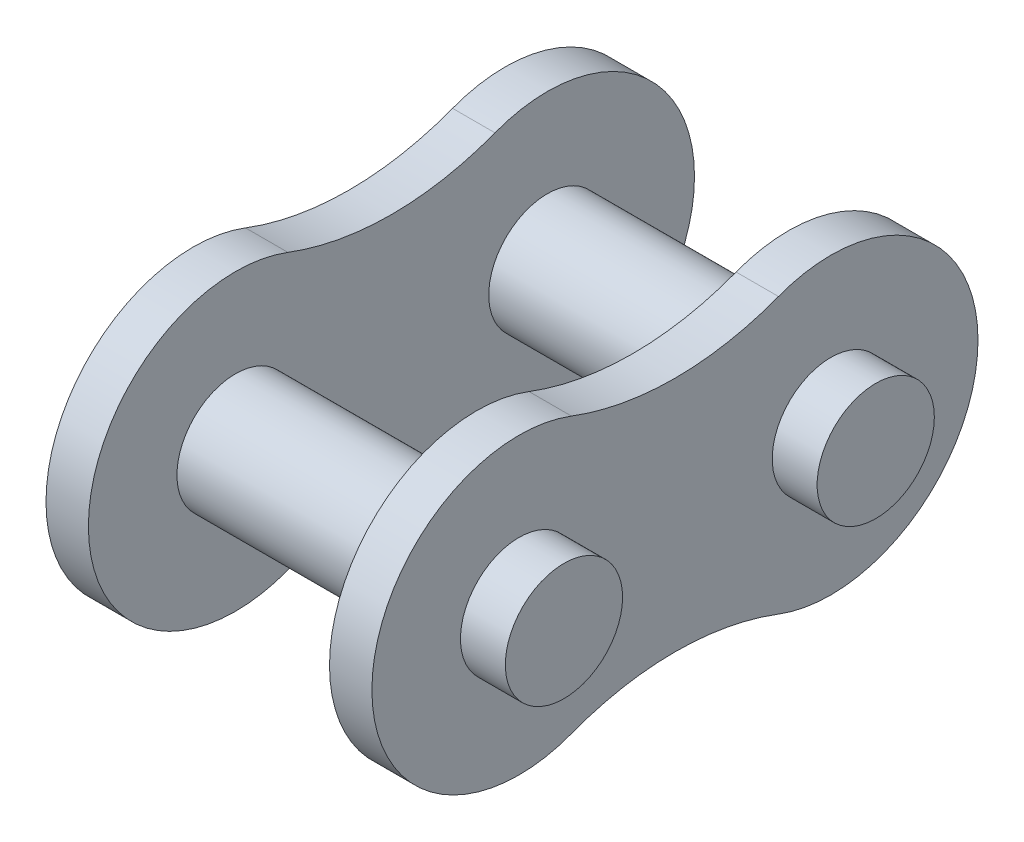
from build123d import *

# Parameters (mm, degrees)
SKETCH1_R             = 1.7907
BOSS_EXTRUDE1_DEPTH   = 6.35
BOSS_EXTRUDE1_2_DEPTH = 6.35
BOSS_EXTRUDE2_START   = 3.683
BOSS_EXTRUDE2_DEPTH   = 1.2954
BOSS_EXTRUDE3_START   = -3.683
SKETCH1_5_R           = 1.7907
BOSS_EXTRUDE3_DEPTH   = 1.2954


with BuildPart() as part:
    # Sketch1 → Boss-Extrude1 (new, symmetric)
    with BuildSketch(Plane(origin=(0, 0, 0), x_dir=(0, 0, -1), z_dir=(1, 0, 0))):
        with Locations((9.525, 0)):
            Circle(SKETCH1_R)
    extrude(amount=BOSS_EXTRUDE1_DEPTH, both=True)


with BuildPart() as body_2:
    # Sketch1 → Boss-Extrude1 2 (new, symmetric)
    with BuildSketch(Plane(origin=(0, 0, 0), x_dir=(0, 0, -1), z_dir=(1, 0, 0))):
        Circle(SKETCH1_R)
    extrude(amount=BOSS_EXTRUDE1_2_DEPTH, both=True)


with BuildPart() as body_3:
    # Sketch1<4> → Boss-Extrude2 (new body)
    with BuildSketch(Plane(origin=(0, 0, 0), x_dir=(0, 0, -1), z_dir=(1, 0, 0)).offset(BOSS_EXTRUDE2_START)):
        with BuildLine():
            ThreePointArc((1.599549336, 4.201625824), (-4.4958, 0), (1.599549336, -4.201625824))
            ThreePointArc((1.599549336, -4.201625824), (4.7625, -3.619925475), (7.925450664, -4.201625824))
            ThreePointArc((7.925450664, -4.201625824), (14.0208, 0), (7.925450664, 4.201625824))
            ThreePointArc((7.925450664, 4.201625824), (4.7625, 3.619925475), (1.599549336, 4.201625824))
        make_face()
    extrude(amount=BOSS_EXTRUDE2_DEPTH)


with BuildPart() as body_4:
    # Sketch1<5> → Boss-Extrude3 (new body)
    with BuildSketch(Plane(origin=(0, 0, 0), x_dir=(0, 0, -1), z_dir=(1, 0, 0)).offset(BOSS_EXTRUDE3_START)):
        with BuildLine():
            ThreePointArc((1.599549336, 4.201625824), (-4.4958, 0), (1.599549336, -4.201625824))
            ThreePointArc((1.599549336, -4.201625824), (4.7625, -3.619925475), (7.925450664, -4.201625824))
            ThreePointArc((7.925450664, -4.201625824), (14.0208, 0), (7.925450664, 4.201625824))
            ThreePointArc((7.925450664, 4.201625824), (4.7625, 3.619925475), (1.599549336, 4.201625824))
        make_face()
        with Locations((9.525, 0)):
            Circle(SKETCH1_5_R, mode=Mode.SUBTRACT)
        Circle(SKETCH1_5_R, mode=Mode.SUBTRACT)
    extrude(amount=-BOSS_EXTRUDE3_DEPTH)


solid = Compound([part.part, body_2.part, body_3.part, body_4.part])
